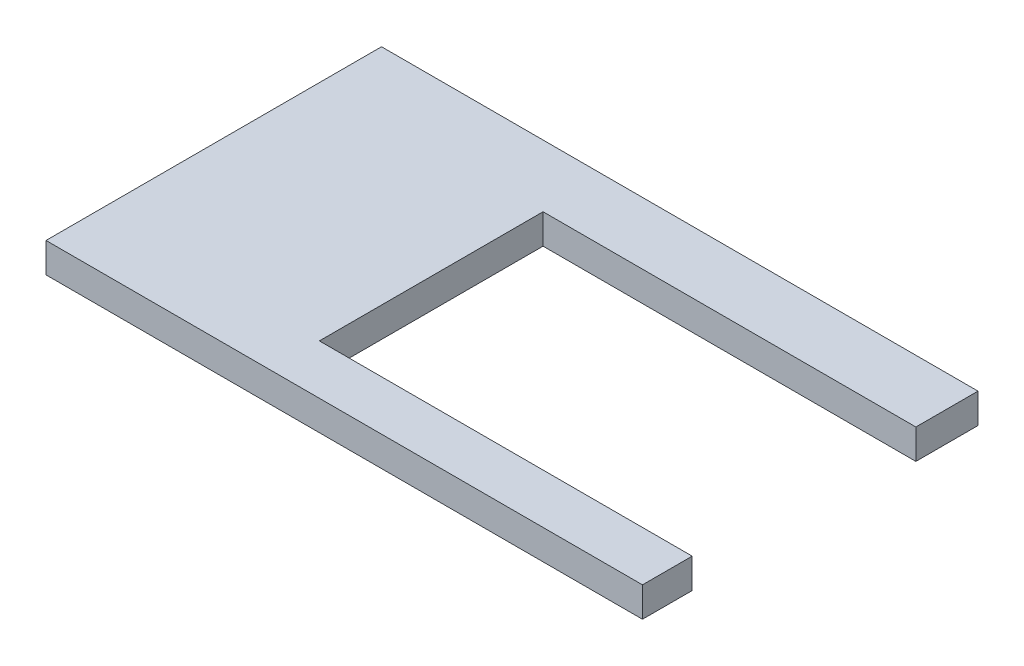
from build123d import *

# Parameters (mm, degrees)
SKETCH1_W           = 19.05
SKETCH1_H           = 2.54
SKETCH1_H_2         = 3.175
BOSS_EXTRUDE1_DEPTH = 1.524


with BuildPart() as part:
    # Sketch1 → Boss-Extrude1 (new body)
    with BuildSketch(Plane(origin=(0, 0, 0), x_dir=(1, 0, 0), z_dir=(0, 1, 0))):
        with Locations((15.24, -7.3025)):
            Rectangle(SKETCH1_W, SKETCH1_H)
        Polygon((5.715, -6.0325), (5.715, 5.3975), (5.715, 8.5725), (-5.715, 8.5725), (-5.715, -8.5725), (5.715, -8.5725), align=None)
        with Locations((15.24, 6.985)):
            Rectangle(SKETCH1_W, SKETCH1_H_2)
    extrude(amount=BOSS_EXTRUDE1_DEPTH)


solid = part.part
